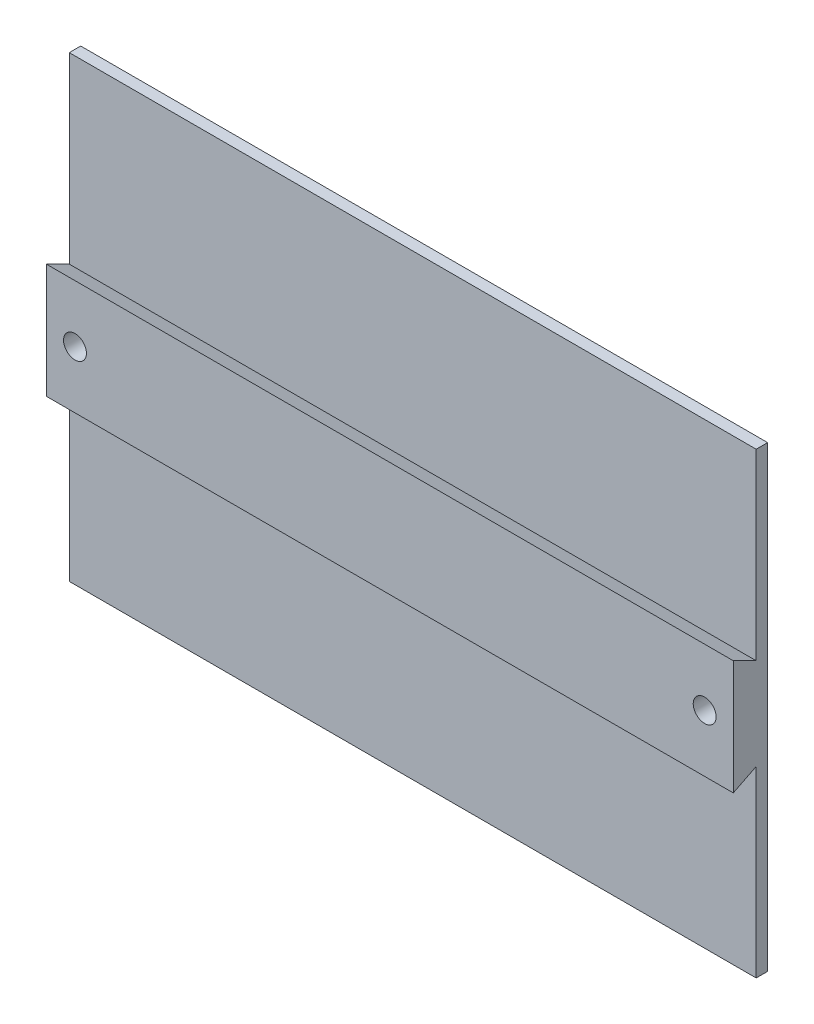
from build123d import *

# Parameters (mm, degrees)
SKETCH1_W             = 15
SKETCH1_H             = 60
BOSS_EXTRUDE1_DEPTH   = 1
BOSS_EXTRUDE1_2_DEPTH = 1
SKETCH1_3_W           = 10
SKETCH1_3_H           = 60
BOSS_EXTRUDE2_DEPTH   = 3
CUT_EXTRUDE1_DEPTH    = 66
SKETCH5_R             = 1
CUT_EXTRUDE2_DEPTH    = 10


with BuildPart() as part:
    # Sketch1 → Boss-Extrude1 (new body)
    with BuildSketch(Plane(origin=(0, 0, 0), x_dir=(0, 1, 0), z_dir=(0, 0, 1))):
        with Locations((-12.5, 0)):
            Rectangle(SKETCH1_W, SKETCH1_H)
    extrude(amount=BOSS_EXTRUDE1_DEPTH)



with BuildPart() as body_2:
    # Sketch1 → Boss-Extrude1 2 (new body)
    with BuildSketch(Plane(origin=(0, 0, 0), x_dir=(0, 1, 0), z_dir=(0, 0, 1))):
        with Locations((12.5, 0)):
            Rectangle(SKETCH1_W, SKETCH1_H)
    extrude(amount=BOSS_EXTRUDE1_2_DEPTH)


with BuildPart() as part_1:
    add(part.part)

    add(body_2.part)  # Boss-Extrude2 merges body 2
    # Sketch1<3> → Boss-Extrude2 (add)
    with BuildSketch(Plane(origin=(0, 0, 0), x_dir=(0, 1, 0), z_dir=(0, 0, 1))):
        Rectangle(SKETCH1_3_W, SKETCH1_3_H)
    extrude(amount=BOSS_EXTRUDE2_DEPTH)

    # Sketch2 → Cut-Extrude1 (cut)
    with BuildSketch(Plane.YZ.offset(30)):
        Polygon((-5, 1), (-4, 1), (-5, 3), align=None)
        Polygon((5, 1), (4, 1), (5, 3), align=None)
    extrude(amount=-CUT_EXTRUDE1_DEPTH, mode=Mode.SUBTRACT)

    # Sketch5 → Cut-Extrude2 (cut)
    with BuildSketch(Plane.XY.offset(3)):
        with Locations((-27.5, 0)):
            Circle(SKETCH5_R)
        with Locations((27.5, 0)):
            Circle(SKETCH5_R)
    extrude(amount=-CUT_EXTRUDE2_DEPTH, mode=Mode.SUBTRACT)


solid = part_1.part
